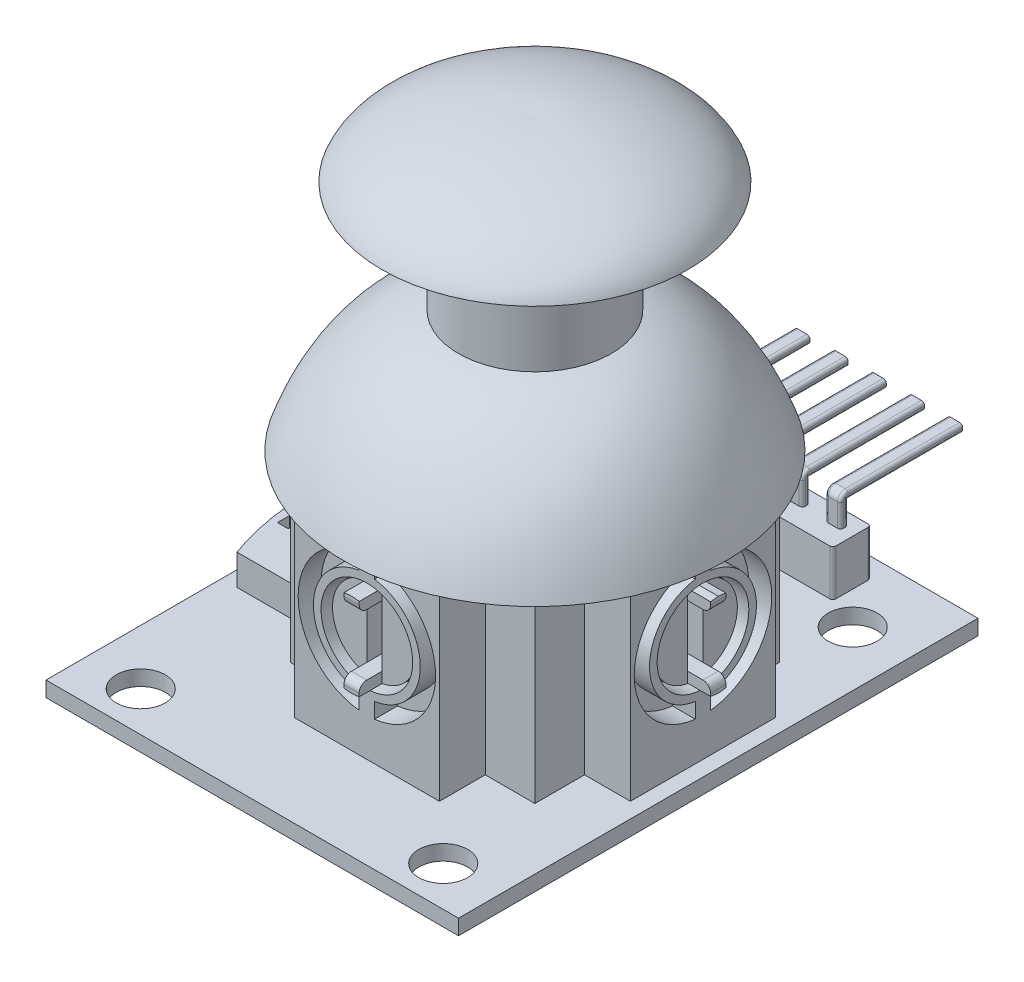
from build123d import *
from build123d.topology import SkipClean

# Parameters (mm, degrees)
IZIM1_W                           = 27
IZIM1_H                           = 34
IZIM1_R                           = 1.6
Y_KSEKLIK_EKSTR_ZYON1_DEPTH       = 1
IZIM2_W                           = 16
IZIM2_H                           = 16
IZIM2_W_2                         = 15.6
IZIM2_H_2                         = 15.6
Y_KSEKLIK_EKSTR_ZYON2_DEPTH       = 12
IZIM3_W                           = 9.5
IZIM3_H                           = 12
Y_KSEKLIK_EKSTR_ZYON3_DEPTH       = 3
IZIM4_R                           = 3
KES_EKSTR_ZYON1_DEPTH             = 1.5
IZIM5_R                           = 2.75
Y_KSEKLIK_EKSTR_ZYON4_DEPTH       = 1
Y_KSEKLIK_EKSTR_ZYON5_DEPTH       = 1.5
RADYUS1_R                         = 0.5
IZIM7_W                           = 1
IZIM7_H                           = 4
KES_EKSTR_ZYON2_DEPTH             = 1.5
IZIM8_W                           = 0.7
IZIM8_H                           = 5
Y_KSEKLIK_EKSTR_ZYON6_DEPTH       = 2
IZIM9_W                           = 5.85
IZIM9_H                           = 4.793448
Y_KSEKLIK_EKSTR_ZYON7_DEPTH       = 1
IZIM10_W                          = 5.65
IZIM10_H                          = 4.793448
Y_KSEKLIK_EKSTR_ZYON8_DEPTH       = 0.2
IZIM11_R                          = 0.15
Y_KSEKLIK_EKSTR_ZYON9_DEPTH       = 0.1
IZIM12_R                          = 1.75
Y_KSEKLIK_EKSTR_ZYON10_DEPTH      = 2
KES_EKSTR_ZYON3_DEPTH             = 2
IZIM14_R                          = 1.5
Y_KSEKLIK_EKSTR_ZYON11_DEPTH      = 31
IZIM15_R                          = 1.4
Y_KSEKLIK_EKSTR_ZYON12_DEPTH      = 8
IZIM17_R                          = 2.15
Y_KSEKLIK_EKSTR_ZYON14_DEPTH      = 2
Y_KSEKLIK_EKSTR_ZYON15_DEPTH      = 1
IZIM22_W                          = 9.5
IZIM22_H                          = 12
Y_KSEKLIK_EKSTR_ZYON16_DEPTH      = 3
KES_EKSTR_ZYON4_DEPTH             = 1.5
IZIM24_R                          = 3
KES_EKSTR_ZYON5_DEPTH             = 1.5
IZIM25_R                          = 2.75
Y_KSEKLIK_EKSTR_ZYON17_DEPTH      = 1
Y_KSEKLIK_EKSTR_ZYON18_DEPTH      = 1.5
RADYUS2_R                         = 0.5
IZIM27_W                          = 1
IZIM27_H                          = 4
KES_EKSTR_ZYON6_DEPTH             = 1.5
Y_KSEKLIK_EKSTR_ZYON19_DEPTH      = 1
Y_KSEKLIK_EKSTR_ZYON20_DEPTH      = 3
Y_KSEKLIK_EKSTR_ZYON21_DEPTH      = 0.5
Y_KSEKLIK_EKSTR_ZYON21_DEPTH_BACK = 0.5
Y_KSEKLIK_EKSTR_ZYON22_DEPTH      = 0.5
Y_KSEKLIK_EKSTR_ZYON22_DEPTH_BACK = 0.5
Y_KSEKLIK_EKSTR_ZYON23_DEPTH      = 0.5
Y_KSEKLIK_EKSTR_ZYON23_DEPTH_BACK = 0.5
Y_KSEKLIK_EKSTR_ZYON24_DEPTH      = 0.5
Y_KSEKLIK_EKSTR_ZYON24_DEPTH_BACK = 0.5
Y_KSEKLIK_EKSTR_ZYON25_DEPTH      = 0.5
Y_KSEKLIK_EKSTR_ZYON25_DEPTH_BACK = 0.5
RADYUS3_R                         = 0.2


with BuildPart() as part:
    # Çizim1 → Yükseklik-Ekstrüzyon1 (new body)
    with BuildSketch(Plane(origin=(0, 0, 0), x_dir=(1, 0, 0), z_dir=(0, 1, 0))):
        Rectangle(IZIM1_W, IZIM1_H)
        with Locations(Location((-9.9, -14.4, 0), (0, 0, 270))):
            Circle(IZIM1_R, mode=Mode.SUBTRACT)
        with Locations(Location((9.9, -14.4, 0), (0, 0, 90))):
            Circle(IZIM1_R, mode=Mode.SUBTRACT)
        with Locations(Location((-9.9, 12.4, 0), (0, 0, 270))):
            Circle(IZIM1_R, mode=Mode.SUBTRACT)
        with Locations(Location((9.9, 12.4, 0), (0, 0, 90))):
            Circle(IZIM1_R, mode=Mode.SUBTRACT)
    extrude(amount=Y_KSEKLIK_EKSTR_ZYON1_DEPTH)

    # Çizim2 → Yükseklik-Ekstrüzyon2 (add)
    with BuildSketch(Plane(origin=(0, 1, 0), x_dir=(1, 0, 0), z_dir=(0, 1, 0))):
        with Locations((1.5, 0)):
            Rectangle(IZIM2_W, IZIM2_H)
        with Locations((1.5, 0)):
            Rectangle(IZIM2_W_2, IZIM2_H_2, mode=Mode.SUBTRACT)
    extrude(amount=Y_KSEKLIK_EKSTR_ZYON2_DEPTH)

    # Çizim3 → Yükseklik-Ekstrüzyon3 (add)
    with BuildSketch(Plane.XY.offset(8)):
        with Locations((1.5, 7)):
            Rectangle(IZIM3_W, IZIM3_H)
    extrude(amount=Y_KSEKLIK_EKSTR_ZYON3_DEPTH)

    # Çizim4 → Kes-Ekstrüzyon1 (cut)
    with BuildSketch(Plane.XY.offset(11)):
        with Locations((1.5, 8)):
            Circle(IZIM4_R)
        with BuildLine():
            Line((1, 12.472136), (1, 11.464102))
            ThreePointArc((1, 11.464102), (-2, 8), (1, 4.535898))
            Line((1, 4.535898), (1, 3.527864))
            ThreePointArc((1, 3.527864), (-3, 8), (1, 12.472136))
        make_face()
        with BuildLine():
            Line((2, 12.472136), (2, 11.464102))
            ThreePointArc((2, 11.464102), (5, 8), (2, 4.535898))
            Line((2, 4.535898), (2, 3.527864))
            ThreePointArc((2, 3.527864), (6, 8), (2, 12.472136))
        make_face()
    extrude(amount=-KES_EKSTR_ZYON1_DEPTH, mode=Mode.SUBTRACT)

    # Çizim5 → Yükseklik-Ekstrüzyon4 (add)
    with BuildSketch(Plane.XY.offset(9.5)):
        with Locations((1.5, 8)):
            Circle(IZIM5_R)
    extrude(amount=Y_KSEKLIK_EKSTR_ZYON4_DEPTH)

    # Çizim6 → Yükseklik-Ekstrüzyon5 (add)
    with SkipClean():  # the faces are left unmerged after this step: merging them gives an invalid solid
        with BuildSketch(Plane.XY.offset(10.5)):
            with BuildLine():
                Line((2, 10.704163), (2, 10))
                Line((2, 10), (1, 10))
                Line((1, 10), (1, 10.704163))
                ThreePointArc((1, 10.704163), (1.5, 10.75), (2, 10.704163))
            make_face()
            with BuildLine():
                Line((1, 6), (2, 6))
                Line((2, 6), (2, 5.295837))
                ThreePointArc((2, 5.295837), (1.5, 5.25), (1, 5.295837))
                Line((1, 5.295837), (1, 6))
            make_face()
        extrude(amount=Y_KSEKLIK_EKSTR_ZYON5_DEPTH)

    # Radyus1
    radyus1_edges = [part.edges().sort_by_distance(p)[0] for p in [
        (1.5, 10, 12),
        (1.5, 6, 12),
    ]]
    fillet(radyus1_edges, radius=RADYUS1_R)

    # Çizim7 → Kes-Ekstrüzyon2 (cut)
    with BuildSketch(Plane.XY.offset(10.5)):
        with Locations((1.5, 8)):
            Rectangle(IZIM7_W, IZIM7_H)
    extrude(amount=-KES_EKSTR_ZYON2_DEPTH, mode=Mode.SUBTRACT)

    # Çizim8 → Yükseklik-Ekstrüzyon6 (add)
    with BuildSketch(Plane(origin=(0, 1, 0), x_dir=(1, 0, 0), z_dir=(0, 1, 0))):
        with BuildLine():
            Line((-12.5, 5.5), (-6.5, 5.5))
            Line((-6.5, 5.5), (-6.5, -5.5))
            Line((-6.5, -5.5), (-12.5, -5.5))
            add(Edge.make_bspline(
                [(-12.5, 5.5), (-14.5, 0), (-12.5, -5.5)],
                knots=[0, 0, 0, 1, 1, 1], degree=2))
        make_face()
        with Locations((-12.5, 0)):
            Rectangle(IZIM8_W, IZIM8_H, mode=Mode.SUBTRACT)
    extrude(amount=Y_KSEKLIK_EKSTR_ZYON6_DEPTH)

    # Çizim9 → Yükseklik-Ekstrüzyon7 (add)
    with BuildSketch(Plane(origin=(0, 3, 0), x_dir=(1, 0, 0), z_dir=(0, 1, 0))):
        with Locations((-9.225, 0)):
            Rectangle(IZIM9_W, IZIM9_H)
    extrude(amount=Y_KSEKLIK_EKSTR_ZYON7_DEPTH)

    # Çizim10 → Yükseklik-Ekstrüzyon8 (add)
    with BuildSketch(Plane(origin=(0, 4, 0), x_dir=(1, 0, 0), z_dir=(0, 1, 0))):
        with Locations((-9.325, 0)):
            Rectangle(IZIM10_W, IZIM10_H)
    extrude(amount=Y_KSEKLIK_EKSTR_ZYON8_DEPTH)

    # Çizim11 → Yükseklik-Ekstrüzyon9 (add)
    with BuildSketch(Plane(origin=(0, 4.2, 0), x_dir=(1, 0, 0), z_dir=(0, 1, 0))):
        with Locations(Location((-11.796392, 2.096724, 0), (0, 0, 270))):
            Circle(IZIM11_R)
        with Locations(Location((-6.853608, 2.096724, 0), (0, 0, 90))):
            Circle(IZIM11_R)
        with Locations(Location((-6.853608, -2.096724, 0), (0, 0, 270))):
            Circle(IZIM11_R)
        with Locations(Location((-11.796392, -2.096724, 0), (0, 0, 90))):
            Circle(IZIM11_R)
    extrude(amount=Y_KSEKLIK_EKSTR_ZYON9_DEPTH)

    # Çizim12 → Yükseklik-Ekstrüzyon10 (add)
    with BuildSketch(Plane(origin=(0, 4.2, 0), x_dir=(1, 0, 0), z_dir=(0, 1, 0))):
        with Locations(Location((-9.325, 0, 0), (0, 0, 270))):
            Circle(IZIM12_R)
    extrude(amount=Y_KSEKLIK_EKSTR_ZYON10_DEPTH)

    # Çizim13 → Kes-Ekstrüzyon3 (cut)
    with BuildSketch(Plane.ZY.offset(6.5)):
        with BuildLine():
            Line((-3.5, 6.2), (-1.926136, 6.2))
            ThreePointArc((-1.926136, 6.2), (0, 11.5), (1.926136, 6.2))
            Line((1.926136, 6.2), (3.5, 6.2))
            ThreePointArc((3.5, 6.2), (3.853553, 6.053553), (4, 5.7))
            Line((4, 5.7), (4, 1))
            Line((4, 1), (-4, 1))
            Line((-4, 1), (-4, 5.7))
            ThreePointArc((-4, 5.7), (-3.853553, 6.053553), (-3.5, 6.2))
        make_face()
    extrude(amount=-KES_EKSTR_ZYON3_DEPTH, mode=Mode.SUBTRACT)

    # Çizim14 → Yükseklik-Ekstrüzyon11 (add)
    with BuildSketch(Plane(origin=(0, 1, 0), x_dir=(1, 0, 0), z_dir=(0, 1, 0))):
        with Locations(Location((1.5, 0, 0), (0, 0, 270))):
            Circle(IZIM14_R)
    extrude(amount=Y_KSEKLIK_EKSTR_ZYON11_DEPTH)

    # Çizim15 → Yükseklik-Ekstrüzyon12 (add)
    with BuildSketch(Plane(origin=(1.5, 0, 0), x_dir=(0, 0, -1), z_dir=(1, 0, 0))):
        with Locations((0, 8.5)):
            Circle(IZIM15_R)
    extrude(amount=-Y_KSEKLIK_EKSTR_ZYON12_DEPTH)

    # Çizim17 → Yükseklik-Ekstrüzyon14 (add)
    with SkipClean():  # the faces are left unmerged after this step: merging them gives an invalid solid
        with BuildSketch(Plane.ZY.offset(6.5)):
            with Locations((0, 8.5)):
                Circle(IZIM17_R)
        extrude(amount=Y_KSEKLIK_EKSTR_ZYON14_DEPTH)

    # Çizim18 → Yükseklik-Ekstrüzyon15 (add)
    with SkipClean():  # the faces are left unmerged after this step: merging them gives an invalid solid
        with BuildSketch(Plane.ZY.offset(8.5)):
            with BuildLine():
                Line((1, 8.5), (1, 10.6))
                ThreePointArc((1, 10.6), (0.941421, 10.741421), (0.8, 10.8))
                Line((0.8, 10.8), (-0.8, 10.8))
                ThreePointArc((-0.8, 10.8), (-0.941421, 10.741421), (-1, 10.6))
                Line((-1, 10.6), (-1, 8.5))
                ThreePointArc((-1, 8.5), (0, 7.5), (1, 8.5))
            make_face()
        extrude(amount=Y_KSEKLIK_EKSTR_ZYON15_DEPTH)



with BuildPart() as body_2:
    # Çizim19 → Döndür1 (revolve)
    with BuildSketch(Plane(origin=(1.5, 0, 0), x_dir=(0, 0, -1), z_dir=(1, 0, 0)), mode=Mode.PRIVATE) as d_nd_r1_sk:
        with BuildLine():
            Line((-12.5, 13), (-12.288133, 13))
            add(Edge.make_bspline(
                [(-12.288133, 13), (-12.111507, 13.502279), (-11.702122, 14.536697), (-11.015704, 15.891074), (-10.226286, 17.116712), (-9.058841, 18.530653), (-7.713634, 19.626363), (-6.197298, 20.40463), (-5.366566, 20.692463), (-4.947265, 20.807078)],
                knots=[0.004762, 0.004762, 0.004762, 0.004762, 0.113958, 0.227916, 0.341874, 0.455832, 0.683748, 0.797706, 0.911664, 0.911664, 0.911664, 0.911664], degree=3))
            Line((-4.947265, 20.807078), (-4.8, 20.807078))
            Line((-4.8, 20.807078), (-4.8, 21))
            Line((-4.8, 21), (-4.8, 28.250085))
            Line((-4.8, 28.250085), (-5, 28.250085))
            Line((-5, 28.250085), (-5, 21))
            add(Edge.make_bspline(
                [(-12.5, 13), (-10.213592, 19.574874), (-5, 21)],
                knots=[0, 0, 0, 0.911664, 0.911664, 0.911664], degree=2))
        make_face()
    revolve(d_nd_r1_sk.sketch.rotate(Axis((1.5, 13, 0), (0, 1, 0)), 180), axis=Axis((1.5, 13, 0), (0, 1, 0)))


with BuildPart() as part_1:
    with SkipClean():  # the faces are left unmerged after this step: merging them gives an invalid solid
        add(part.part)

        add(body_2.part)  # Döndür3 merges body 2
        # Çizim21 → Döndür3 (revolve)
        with BuildSketch(Plane(origin=(1.5, 0, 0), x_dir=(0, 0, -1), z_dir=(1, 0, 0)), mode=Mode.PRIVATE) as d_nd_r3_sk:
            with BuildLine():
                Line((0, 32), (0, 31.800503))
                Line((0, 31.800503), (-0.014182, 31.800503))
                add(Edge.make_bspline(
                    [(-0.014182, 31.800503), (-0.21638, 31.814878), (-0.610932, 31.829554), (-1.487447, 31.813408), (-2.658294, 31.705464), (-4.127855, 31.444872), (-5.581424, 31.059598), (-6.945351, 30.557646), (-8.144428, 29.947028), (-8.941287, 29.360532), (-9.424448, 28.847791), (-9.603184, 28.590125), (-9.682203, 28.450085)],
                    knots=[0, 0, 0, 0, 0.047842, 0.095684, 0.191367, 0.287051, 0.382735, 0.478418, 0.574102, 0.669786, 0.717628, 0.765469, 0.765469, 0.765469, 0.765469], degree=3))
                Line((-9.682203, 28.450085), (-4.40609, 28.450085))
                Line((-4.40609, 28.450085), (-4.40609, 28.250085))
                Line((-4.40609, 28.250085), (-10, 28.250085))
                add(Edge.make_bspline(
                    [(0, 32), (-0.745802, 32.053019), (-4.590452, 31.898517), (-9.220348, 30.199043), (-10, 28.250085)],
                    knots=[0, 0, 0, 0, 0.179556, 0.797541, 0.797541, 0.797541, 0.797541], degree=3))
            make_face()
        revolve(d_nd_r3_sk.sketch.rotate(Axis((1.5, 28.250085, 0), (0, 1, 0)), 180), axis=Axis((1.5, 28.250085, 0), (0, 1, 0)))

    # Çizim22 → Yükseklik-Ekstrüzyon16 (add)
    with SkipClean():  # the faces are left unmerged after this step: merging them gives an invalid solid
        with BuildSketch(Plane(origin=(9.5, 0, 0), x_dir=(0, 0, -1), z_dir=(1, 0, 0))):
            with Locations((0, 7)):
                Rectangle(IZIM22_W, IZIM22_H)
        extrude(amount=Y_KSEKLIK_EKSTR_ZYON16_DEPTH)

    # Çizim23 → Kes-Ekstrüzyon4 (cut)
    with SkipClean():  # the faces are left unmerged after this step: merging them gives an invalid solid
        with BuildSketch(Plane(origin=(12.5, 0, 0), x_dir=(0, 0, -1), z_dir=(1, 0, 0))):
            with BuildLine():
                Line((-0.5, 12.472136), (-0.5, 11.464102))
                ThreePointArc((-0.5, 11.464102), (-3.5, 8), (-0.5, 4.535898))
                Line((-0.5, 4.535898), (-0.5, 3.527864))
                ThreePointArc((-0.5, 3.527864), (-4.5, 8), (-0.5, 12.472136))
            make_face()
            with BuildLine():
                Line((0.5, 12.472136), (0.5, 11.464102))
                ThreePointArc((0.5, 11.464102), (3.5, 8), (0.5, 4.535898))
                Line((0.5, 4.535898), (0.5, 3.527864))
                ThreePointArc((0.5, 3.527864), (4.5, 8), (0.5, 12.472136))
            make_face()
        extrude(amount=-KES_EKSTR_ZYON4_DEPTH, mode=Mode.SUBTRACT)

    # Çizim24 → Kes-Ekstrüzyon5 (cut)
    with SkipClean():  # the faces are left unmerged after this step: merging them gives an invalid solid
        with BuildSketch(Plane(origin=(12.5, 0, 0), x_dir=(0, 0, -1), z_dir=(1, 0, 0))):
            with Locations((0, 8)):
                Circle(IZIM24_R)
        extrude(amount=-KES_EKSTR_ZYON5_DEPTH, mode=Mode.SUBTRACT)

    # Çizim25 → Yükseklik-Ekstrüzyon17 (add)
    with SkipClean():  # the faces are left unmerged after this step: merging them gives an invalid solid
        with BuildSketch(Plane(origin=(11, 0, 0), x_dir=(0, 0, -1), z_dir=(1, 0, 0))):
            with Locations((0, 8)):
                Circle(IZIM25_R)
        extrude(amount=Y_KSEKLIK_EKSTR_ZYON17_DEPTH)

    # Çizim26 → Yükseklik-Ekstrüzyon18 (add)
    with SkipClean():  # the faces are left unmerged after this step: merging them gives an invalid solid
        with BuildSketch(Plane(origin=(12, 0, 0), x_dir=(0, 0, -1), z_dir=(1, 0, 0))):
            Polygon((0.5, 10), (-0.5, 10), (-0.5, 10.683557), (0, 10.75), (0.5, 10.683557), align=None)
            Polygon((0.5, 6), (0.5, 5.316705), (0, 5.25), (-0.5, 5.316705), (-0.5, 6), align=None)
        extrude(amount=Y_KSEKLIK_EKSTR_ZYON18_DEPTH)

    # Radyus2
    radyus2_edges = [part_1.edges().sort_by_distance(p)[0] for p in [
        (13.5, 10, 0),
        (13.5, 6, 0),
    ]]
    fillet(radyus2_edges, radius=RADYUS2_R)

    # Çizim27 → Kes-Ekstrüzyon6 (cut)
    with SkipClean():  # the faces are left unmerged after this step: merging them gives an invalid solid
        with BuildSketch(Plane(origin=(12, 0, 0), x_dir=(0, 0, -1), z_dir=(1, 0, 0))):
            with Locations((0, 8)):
                Rectangle(IZIM27_W, IZIM27_H)
        extrude(amount=-KES_EKSTR_ZYON6_DEPTH, mode=Mode.SUBTRACT)

    # Çizim28 → Yükseklik-Ekstrüzyon19 (add)
    with SkipClean():  # the faces are left unmerged after this step: merging them gives an invalid solid
        with BuildSketch(Plane(origin=(0, 0, -8), x_dir=(-1, 0, 0), z_dir=(0, 0, -1))):
            Polygon((-5, 8), (-3.5, 8), (-3.5, 7), (0.5, 7), (0.5, 8), (2, 8), (2.5, 7.5), (2.5, 1), (-5.5, 1), (-5.5, 7.5), align=None)
        extrude(amount=Y_KSEKLIK_EKSTR_ZYON19_DEPTH)

    # Çizim29 → Yükseklik-Ekstrüzyon20 (add)
    with SkipClean():  # the faces are left unmerged after this step: merging them gives an invalid solid
        with BuildSketch(Plane(origin=(0, 1, 0), x_dir=(1, 0, 0), z_dir=(0, 1, 0))):
            with BuildLine():
                Line((-4.55, 15.75), (7.55, 15.75))
                ThreePointArc((7.55, 15.75), (7.691421, 15.691421), (7.75, 15.55))
                Line((7.75, 15.55), (7.75, 13.45))
                ThreePointArc((7.75, 13.45), (7.691421, 13.308579), (7.55, 13.25))
                Line((7.55, 13.25), (-4.55, 13.25))
                ThreePointArc((-4.55, 13.25), (-4.691421, 13.308579), (-4.75, 13.45))
                Line((-4.75, 13.45), (-4.75, 15.55))
                ThreePointArc((-4.75, 15.55), (-4.691421, 15.691421), (-4.55, 15.75))
            make_face()
        extrude(amount=Y_KSEKLIK_EKSTR_ZYON20_DEPTH)

    # Çizim30 → Yükseklik-Ekstrüzyon21 (add, two sides: drawn at the far end of the back side and taken through both)
    with SkipClean():  # the faces are left unmerged after this step: merging them gives an invalid solid
        with BuildSketch(Plane(origin=(1.5, 0, 0), x_dir=(0, 0, -1), z_dir=(1, 0, 0)).offset(-Y_KSEKLIK_EKSTR_ZYON21_DEPTH_BACK)):
            with BuildLine():
                Line((14.5, 4), (14.5, 5.5))
                ThreePointArc((14.5, 5.5), (14.646447, 5.853553), (15, 6))
                Line((15, 6), (22.5, 6))
                Line((22.5, 6), (22.5, 5.5))
                Line((22.5, 5.5), (15, 5.5))
                Line((15, 5.5), (15, 4))
                Line((15, 4), (14.5, 4))
            make_face()
        extrude(amount=Y_KSEKLIK_EKSTR_ZYON21_DEPTH + Y_KSEKLIK_EKSTR_ZYON21_DEPTH_BACK)

    # Çizim31 → Yükseklik-Ekstrüzyon22 (add, two sides: drawn at the far end of the back side and taken through both)
    with SkipClean():  # the faces are left unmerged after this step: merging them gives an invalid solid
        with BuildSketch(Plane(origin=(4, 0, 0), x_dir=(0, 0, -1), z_dir=(1, 0, 0)).offset(-Y_KSEKLIK_EKSTR_ZYON22_DEPTH_BACK)):
            with BuildLine():
                Line((14.5, 4), (14.5, 5.5))
                ThreePointArc((14.5, 5.5), (14.646447, 5.853553), (15, 6))
                Line((15, 6), (22.5, 6))
                Line((22.5, 6), (22.5, 5.5))
                Line((22.5, 5.5), (15, 5.5))
                Line((15, 5.5), (15, 4))
                Line((15, 4), (14.5, 4))
            make_face()
        extrude(amount=Y_KSEKLIK_EKSTR_ZYON22_DEPTH + Y_KSEKLIK_EKSTR_ZYON22_DEPTH_BACK)

    # Çizim33 → Yükseklik-Ekstrüzyon23 (add, two sides: drawn at the far end of the back side and taken through both)
    with SkipClean():  # the faces are left unmerged after this step: merging them gives an invalid solid
        with BuildSketch(Plane(origin=(6.5, 0, 0), x_dir=(0, 0, -1), z_dir=(1, 0, 0)).offset(-Y_KSEKLIK_EKSTR_ZYON23_DEPTH_BACK)):
            with BuildLine():
                Line((14.5, 4), (14.5, 5.5))
                ThreePointArc((14.5, 5.5), (14.646447, 5.853553), (15, 6))
                Line((15, 6), (22.5, 6))
                Line((22.5, 6), (22.5, 5.5))
                Line((22.5, 5.5), (15, 5.5))
                Line((15, 5.5), (15, 4))
                Line((15, 4), (14.5, 4))
            make_face()
        extrude(amount=Y_KSEKLIK_EKSTR_ZYON23_DEPTH + Y_KSEKLIK_EKSTR_ZYON23_DEPTH_BACK)

    # Çizim34 → Yükseklik-Ekstrüzyon24 (add, two sides: drawn at the far end of the back side and taken through both)
    with SkipClean():  # the faces are left unmerged after this step: merging them gives an invalid solid
        with BuildSketch(Plane(origin=(-1, 0, 0), x_dir=(0, 0, -1), z_dir=(1, 0, 0)).offset(-Y_KSEKLIK_EKSTR_ZYON24_DEPTH_BACK)):
            with BuildLine():
                Line((14.5, 4), (14.5, 5.5))
                ThreePointArc((14.5, 5.5), (14.646447, 5.853553), (15, 6))
                Line((15, 6), (22.5, 6))
                Line((22.5, 6), (22.5, 5.5))
                Line((22.5, 5.5), (15, 5.5))
                Line((15, 5.5), (15, 4))
                Line((15, 4), (14.5, 4))
            make_face()
        extrude(amount=Y_KSEKLIK_EKSTR_ZYON24_DEPTH + Y_KSEKLIK_EKSTR_ZYON24_DEPTH_BACK)

    # Çizim35 → Yükseklik-Ekstrüzyon25 (add, two sides: drawn at the far end of the back side and taken through both)
    with SkipClean():  # the faces are left unmerged after this step: merging them gives an invalid solid
        with BuildSketch(Plane(origin=(-3.5, 0, 0), x_dir=(0, 0, -1), z_dir=(1, 0, 0)).offset(-Y_KSEKLIK_EKSTR_ZYON25_DEPTH_BACK)):
            with BuildLine():
                Line((14.5, 4), (14.5, 5.5))
                ThreePointArc((14.5, 5.5), (14.646447, 5.853553), (15, 6))
                Line((15, 6), (22.5, 6))
                Line((22.5, 6), (22.5, 5.5))
                Line((22.5, 5.5), (15, 5.5))
                Line((15, 5.5), (15, 4))
                Line((15, 4), (14.5, 4))
            make_face()
        extrude(amount=Y_KSEKLIK_EKSTR_ZYON25_DEPTH + Y_KSEKLIK_EKSTR_ZYON25_DEPTH_BACK)

    # Radyus3
    radyus3_edges = [part_1.edges().sort_by_distance(p)[0] for p in [
        (1, 4.75, -14.5),
        (1, 5.853553, -14.646447),
        (1, 6, -18.75),
        (1, 5.5, -18.75),
        (1, 4.75, -15),
        (2, 4.75, -15),
        (2, 5.5, -18.75),
        (2, 6, -18.75),
        (2, 5.853553, -14.646447),
        (2, 4.75, -14.5),
        (3.5, 4.75, -14.5),
        (3.5, 5.853553, -14.646447),
        (3.5, 6, -18.75),
        (3.5, 5.5, -18.75),
        (3.5, 4.75, -15),
        (4.5, 4.75, -15),
        (4.5, 5.5, -18.75),
        (4.5, 6, -18.75),
        (4.5, 5.853553, -14.646447),
        (4.5, 4.75, -14.5),
        (6, 4.75, -14.5),
        (6, 5.853553, -14.646447),
        (6, 6, -18.75),
        (6, 5.5, -18.75),
        (6, 4.75, -15),
        (7, 4.75, -15),
        (7, 5.5, -18.75),
        (7, 6, -18.75),
        (7, 5.853553, -14.646447),
        (7, 4.75, -14.5),
        (-1.5, 4.75, -14.5),
        (-1.5, 5.853553, -14.646447),
        (-1.5, 6, -18.75),
        (-1.5, 5.5, -18.75),
        (-1.5, 4.75, -15),
        (-0.5, 4.75, -15),
        (-0.5, 5.5, -18.75),
        (-0.5, 6, -18.75),
        (-0.5, 5.853553, -14.646447),
        (-0.5, 4.75, -14.5),
        (-4, 4.75, -14.5),
        (-4, 5.853553, -14.646447),
        (-4, 6, -18.75),
        (-4, 5.5, -18.75),
        (-4, 4.75, -15),
        (-3, 4.75, -15),
        (-3, 5.5, -18.75),
        (-3, 6, -18.75),
        (-3, 5.853553, -14.646447),
        (-3, 4.75, -14.5),
    ]]
    fillet(radyus3_edges, radius=RADYUS3_R)


solid = part_1.part
